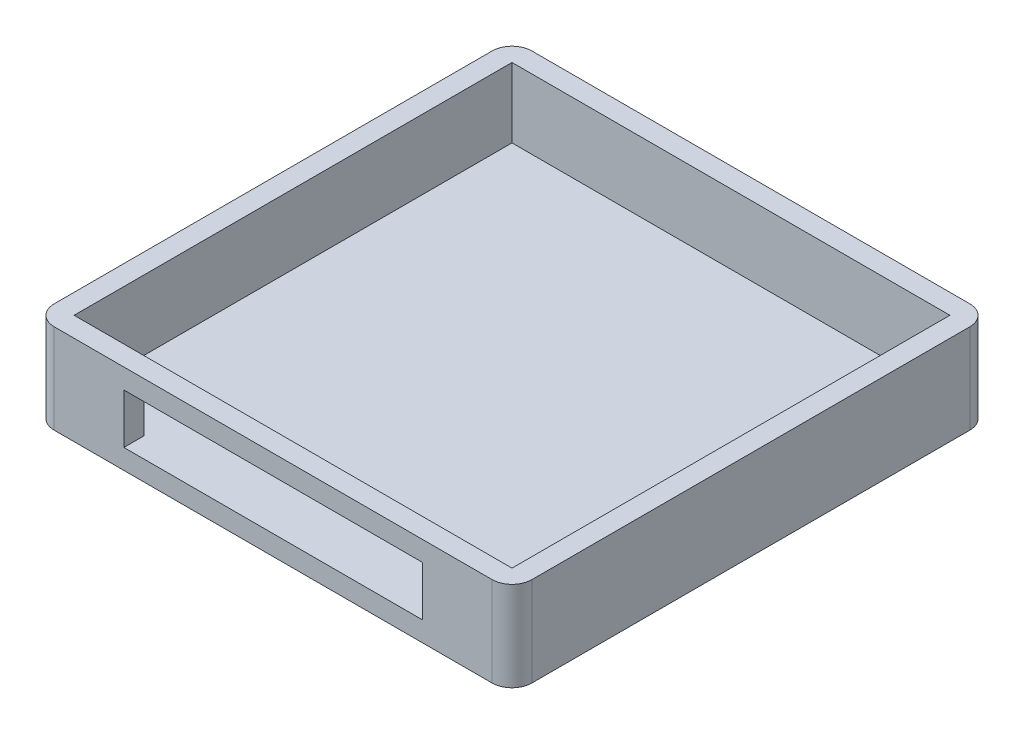
from build123d import *

# Parameters (mm, degrees)
SKETCH1_W           = 48
SKETCH1_H           = 48
BOSS_EXTRUDE1_DEPTH = 9
SKETCH2_W           = 44
SKETCH2_H           = 44
CUT_EXTRUDE1_DEPTH  = 7
SKETCH3_R           = 6
BOSS_EXTRUDE2_DEPTH = 10
SKETCH4_R           = 3.6
CUT_EXTRUDE2_DEPTH  = 10
SKETCH5_W           = 30
SKETCH5_H           = 5
CUT_EXTRUDE3_DEPTH  = 10
FILLET1_R           = 2


with BuildPart() as part:
    # Sketch1 → Boss-Extrude1 (new body)
    with BuildSketch(Plane(origin=(0, 0, 0), x_dir=(1, 0, 0), z_dir=(0, 1, 0))):
        Rectangle(SKETCH1_W, SKETCH1_H)
    extrude(amount=BOSS_EXTRUDE1_DEPTH)

    # Sketch2 → Cut-Extrude1 (cut)
    with BuildSketch(Plane(origin=(0, 9, 0), x_dir=(1, 0, 0), z_dir=(0, 1, 0))):
        Rectangle(SKETCH2_W, SKETCH2_H)
    extrude(amount=-CUT_EXTRUDE1_DEPTH, mode=Mode.SUBTRACT)

    # Sketch3 → Boss-Extrude2 (add)
    with BuildSketch(Plane.XZ):
        with Locations(Location((0, 0, 0), (0, 0, 270))):
            Circle(SKETCH3_R)
    extrude(amount=BOSS_EXTRUDE2_DEPTH)

    # Sketch4 → Cut-Extrude2 (cut)
    with BuildSketch(Plane.XZ.offset(10)):
        with Locations(Location((0, 0, 0), (0, 0, 270))):
            Circle(SKETCH4_R)
    extrude(amount=-CUT_EXTRUDE2_DEPTH, mode=Mode.SUBTRACT)

    # Sketch5 → Cut-Extrude3 (cut)
    with BuildSketch(Plane.XY.offset(24)):
        with Locations((0, 4.5)):
            Rectangle(SKETCH5_W, SKETCH5_H)
    extrude(amount=-CUT_EXTRUDE3_DEPTH, mode=Mode.SUBTRACT)

    # Fillet1
    fillet1_edges = [part.edges().sort_by_distance(p)[0] for p in [
        (24, 4.5, 24),
        (-24, 4.5, 24),
        (-24, 4.5, -24),
        (24, 4.5, -24),
    ]]
    fillet(fillet1_edges, radius=FILLET1_R)


solid = part.part
